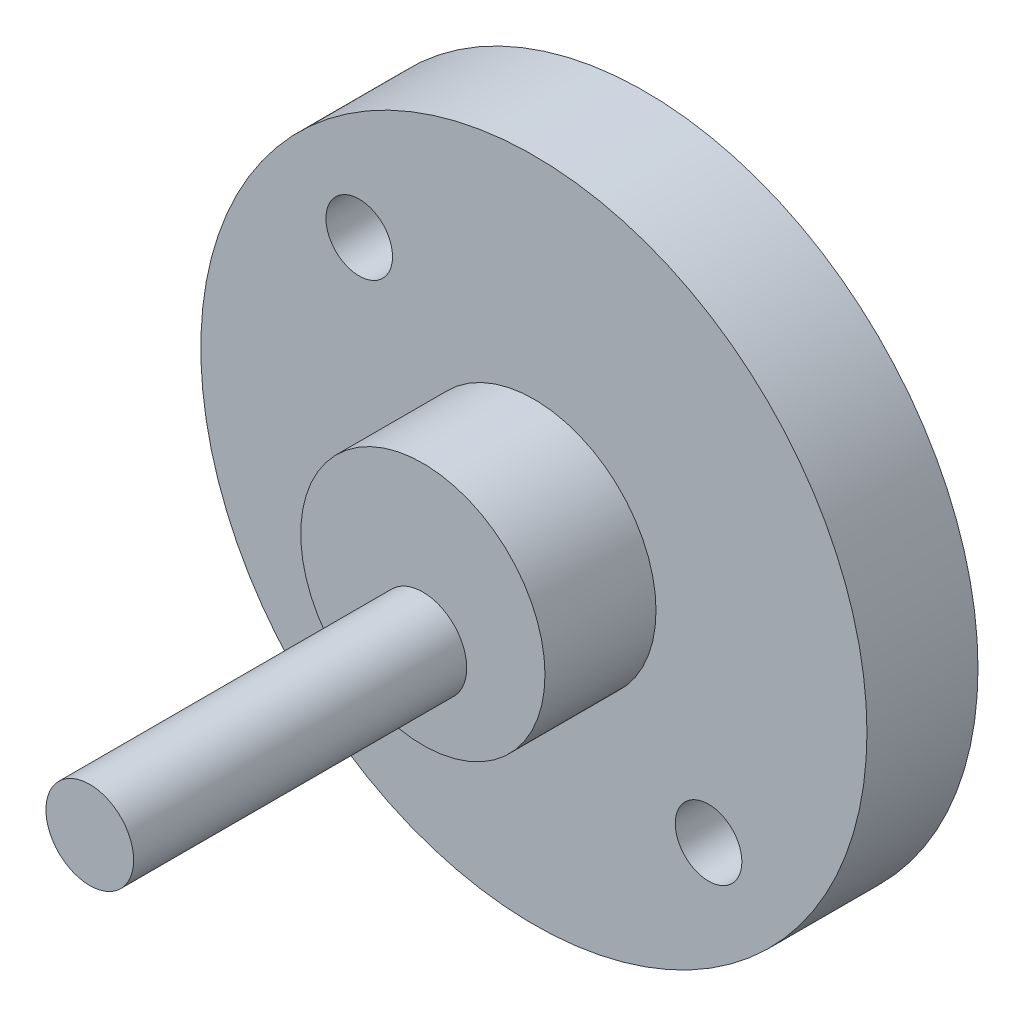
from build123d import *

# Parameters (mm, degrees)
SKETCH1_R             = 30
BOSS_EXTRUDE1_DEPTH   = 10
F_6_0MM_DOWEL_HOLE1_D = 6
SKETCH2_R             = 11
BOSS_EXTRUDE2_DEPTH   = 10
SKETCH9_R             = 3.95
BOSS_EXTRUDE3_DEPTH   = 30


with BuildPart() as part:
    # Sketch1 → Boss-Extrude1 (new body)
    with BuildSketch(Plane.XY):
        Circle(SKETCH1_R)
    extrude(amount=BOSS_EXTRUDE1_DEPTH)

    # Ø6.0mm Dowel Hole1 (through all)
    with Locations(Plane.XY.offset(10)):
        with Locations((-15.733125881, 15.733125881), (15.733125881, -15.733125881), (-15.733125881, -15.733125881)):
            Hole(F_6_0MM_DOWEL_HOLE1_D / 2)

    # Sketch2 → Boss-Extrude2 (add)
    with BuildSketch(Plane.XY.offset(10)):
        Circle(SKETCH2_R)
    extrude(amount=BOSS_EXTRUDE2_DEPTH)

    # Sketch9 → Boss-Extrude3 (add)
    with BuildSketch(Plane.XY.offset(20)):
        with Locations((0, -3)):
            Circle(SKETCH9_R)
    extrude(amount=BOSS_EXTRUDE3_DEPTH)


solid = part.part
